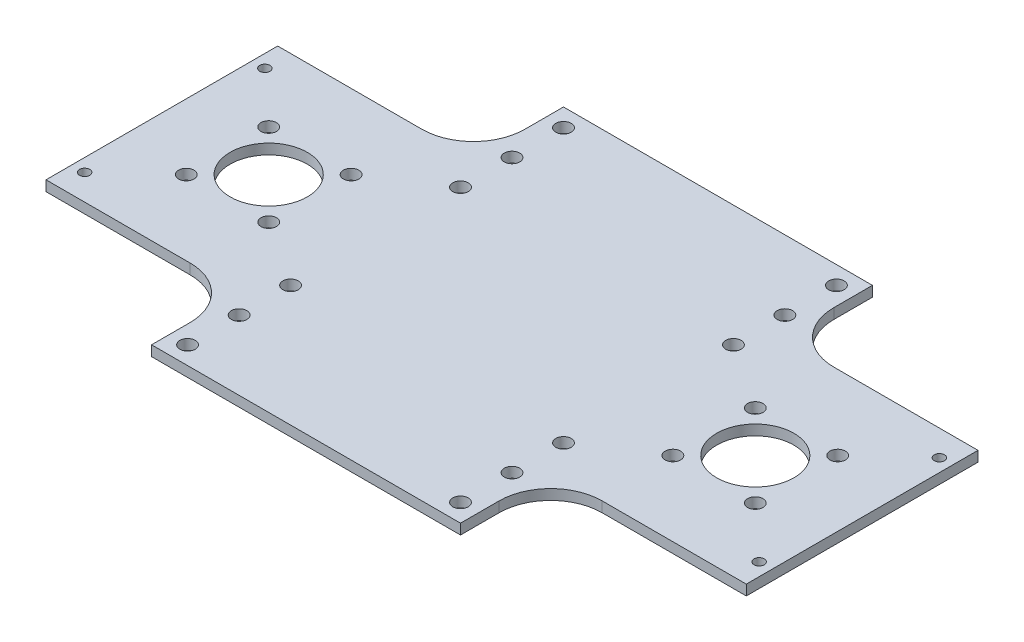
from build123d import *

# Parameters (mm, degrees)
BOSS_EXTRUDE1_DEPTH           = 2
M2_CLEARANCE_HOLE1_D          = 2
M2_CLEARANCE_HOLE1_DEPTH      = 2
M2_CLEARANCE_HOLE1_TIP        = 0.600860619
M3_CLEARANCE_HOLE1_D          = 3
M3_CLEARANCE_HOLE2_D          = 3
M3_CLEARANCE_HOLE2_DEPTH      = 2
M3_CLEARANCE_HOLE2_TIP        = 0.901290929
M3_CLEARANCE_HOLE3_D          = 3
M3_CLEARANCE_HOLE3_DEPTH      = 2
M3_CLEARANCE_HOLE3_TIP        = 0.901290929
FILLET1_R                     = 10
FILLET2_R                     = 10
FILLET3_R                     = 10
FILLET4_R                     = 10
M14_CLEARANCE_HOLE1_D         = 15
M3_CLEARANCE_HOLE4_AT_2_COUNT = 2
M3_CLEARANCE_HOLE4_AT_2_PITCH = 16
M3_CLEARANCE_HOLE4_AT_3_COUNT = 2
M3_CLEARANCE_HOLE4_AT_3_PITCH = 22.627416998
M3_CLEARANCE_HOLE4_AT_4_COUNT = 2
M3_CLEARANCE_HOLE4_AT_4_PITCH = 16
LPATTERN1_COUNT               = 2
LPATTERN1_PITCH               = 94.5


with BuildPart() as part:
    # Sketch1 → Boss-Extrude1 (new body)
    with BuildSketch(Plane(origin=(0, 0, 0), x_dir=(1, 0, 0), z_dir=(0, 1, 0))):
        Polygon((98, 45), (136, 45), (136, 0), (98, 0), (98, -17.5), (38, -17.5), (38, 0), (0, 0), (0, 45), (38, 45), (38, 62.5), (98, 62.5), align=None)
    extrude(amount=BOSS_EXTRUDE1_DEPTH)

    # M2 Clearance Hole1
    with Locations(Plane(origin=(0, 2, 0), x_dir=(1, 0, 0), z_dir=(0, 1, 0))):
        with Locations((2.5, 5), (2.5, 40), (133.5, 40), (133.5, 5)):
            Hole(M2_CLEARANCE_HOLE1_D / 2, depth=M2_CLEARANCE_HOLE1_DEPTH)
            with Locations((0, 0, -(M2_CLEARANCE_HOLE1_DEPTH + M2_CLEARANCE_HOLE1_TIP / 2))):  # 118° drill point
                Cone(0, M2_CLEARANCE_HOLE1_D / 2, M2_CLEARANCE_HOLE1_TIP, mode=Mode.SUBTRACT)

    # M3 Clearance Hole1 (through all)
    with Locations(Plane(origin=(0, 2, 0), x_dir=(1, 0, 0), z_dir=(0, 1, 0))):
        with Locations((41.5, 39), (94.5, 39), (94.5, -14), (41.5, -14)):
            Hole(M3_CLEARANCE_HOLE1_D / 2)

    # M3 Clearance Hole2
    with Locations(Plane(origin=(0, 2, 0), x_dir=(1, 0, 0), z_dir=(0, 1, 0))):
        with Locations((41.5, -4), (94.5, -4), (94.5, 49), (41.5, 49)):
            Hole(M3_CLEARANCE_HOLE2_D / 2, depth=M3_CLEARANCE_HOLE2_DEPTH)
            with Locations((0, 0, -(M3_CLEARANCE_HOLE2_DEPTH + M3_CLEARANCE_HOLE2_TIP / 2))):  # 118° drill point
                Cone(0, M3_CLEARANCE_HOLE2_D / 2, M3_CLEARANCE_HOLE2_TIP, mode=Mode.SUBTRACT)

    # M3 Clearance Hole3
    with Locations(Plane(origin=(0, 2, 0), x_dir=(1, 0, 0), z_dir=(0, 1, 0))):
        with Locations((41.5, 59), (94.5, 59), (94.5, 6), (41.5, 6)):
            Hole(M3_CLEARANCE_HOLE3_D / 2, depth=M3_CLEARANCE_HOLE3_DEPTH)
            with Locations((0, 0, -(M3_CLEARANCE_HOLE3_DEPTH + M3_CLEARANCE_HOLE3_TIP / 2))):  # 118° drill point
                Cone(0, M3_CLEARANCE_HOLE3_D / 2, M3_CLEARANCE_HOLE3_TIP, mode=Mode.SUBTRACT)

    # Fillet1
    fillet1_edges = [part.edges().sort_by_distance(p)[0] for p in [
        (98, 1, 0),
    ]]
    fillet(fillet1_edges, radius=FILLET1_R)

    # Fillet2
    fillet2_edges = [part.edges().sort_by_distance(p)[0] for p in [
        (98, 1, -45),
    ]]
    fillet(fillet2_edges, radius=FILLET2_R)

    # Fillet3
    fillet3_edges = [part.edges().sort_by_distance(p)[0] for p in [
        (38, 1, 0),
    ]]
    fillet(fillet3_edges, radius=FILLET3_R)

    # Fillet4
    fillet4_edges = [part.edges().sort_by_distance(p)[0] for p in [
        (38, 1, -45),
    ]]
    fillet(fillet4_edges, radius=FILLET4_R)

    # M14 Clearance Hole1 (through all)
    with Locations(Plane(origin=(0, 2, 0), x_dir=(1, 0, 0), z_dir=(0, 1, 0))):
        with Locations((115.25, 22.5), (20.75, 22.5)):
            Hole(M14_CLEARANCE_HOLE1_D / 2)

    # Sketch14 → M3 Clearance Hole4 (revolve, cut)
    with BuildSketch(Plane(origin=(107.25, 2, -30.5), x_dir=(0, 0, 1), z_dir=(1, 0, 0))):
        Polygon((0, 0), (0, 2.901290929), (1.5, 2), (1.5, 0), align=None)
    m3_clearance_hole4 = revolve(axis=Axis((107.25, 8.35, -30.5), (0, -1, 0)), mode=Mode.SUBTRACT)

    # M3 Clearance Hole4 at 2: M3 Clearance Hole4 ×2
    with Locations(*[(i * M3_CLEARANCE_HOLE4_AT_2_PITCH, 0, 0) for i in range(1, M3_CLEARANCE_HOLE4_AT_2_COUNT)]):
        add(m3_clearance_hole4, mode=Mode.SUBTRACT)

    # M3 Clearance Hole4 at 3: M3 Clearance Hole4 ×2
    with Locations(*[Vector(0.7071067811865472, 0, 0.7071067811865479) * (i * M3_CLEARANCE_HOLE4_AT_3_PITCH) for i in range(1, M3_CLEARANCE_HOLE4_AT_3_COUNT)]):
        add(m3_clearance_hole4, mode=Mode.SUBTRACT)

    # M3 Clearance Hole4 at 4: M3 Clearance Hole4 ×2
    with Locations(*[(0, 0, i * M3_CLEARANCE_HOLE4_AT_4_PITCH) for i in range(1, M3_CLEARANCE_HOLE4_AT_4_COUNT)]):
        add(m3_clearance_hole4, mode=Mode.SUBTRACT)

    # LPattern1: M3 Clearance Hole4 ×2
    with Locations(*[(-i * LPATTERN1_PITCH, 0, 0) for i in range(1, LPATTERN1_COUNT)]):
        add(m3_clearance_hole4, mode=Mode.SUBTRACT)

    # LPattern1 copy 1 sketch → LPattern1 copy 1 (revolve, cut)
    with BuildSketch(Plane(origin=(28.75, 2, -30.5), x_dir=(0, 0, 1), z_dir=(1, 0, 0))):
        Polygon((0, 0), (0, 2.901290929), (1.5, 2), (1.5, 0), align=None)
    revolve(axis=Axis((28.75, 8.35, -30.5), (0, -1, 0)), mode=Mode.SUBTRACT)

    # LPattern1 copy 2 sketch → LPattern1 copy 2 (revolve, cut)
    with BuildSketch(Plane(origin=(28.75, 2, -14.5), x_dir=(0, 0, 1), z_dir=(1, 0, 0))):
        Polygon((0, 0), (0, 2.901290929), (1.5, 2), (1.5, 0), align=None)
    revolve(axis=Axis((28.75, 8.35, -14.5), (0, -1, 0)), mode=Mode.SUBTRACT)

    # LPattern1 copy 3 sketch → LPattern1 copy 3 (revolve, cut)
    with BuildSketch(Plane(origin=(12.75, 2, -14.5), x_dir=(0, 0, 1), z_dir=(1, 0, 0))):
        Polygon((0, 0), (0, 2.901290929), (1.5, 2), (1.5, 0), align=None)
    revolve(axis=Axis((12.75, 8.35, -14.5), (0, -1, 0)), mode=Mode.SUBTRACT)


solid = part.part
